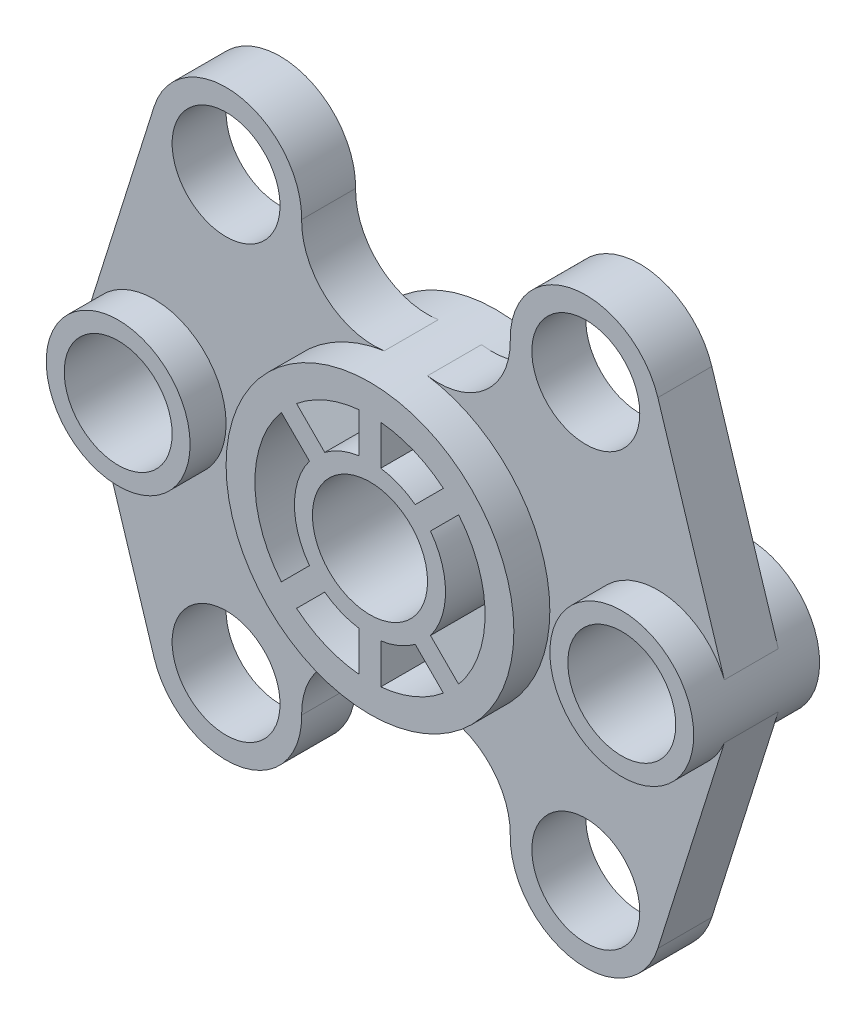
from build123d import *

# Parameters (mm, degrees)
SKETCH1_R           = 20
SKETCH1_R_2         = 15
SKETCH1_R_3         = 40
SKETCH1_R_4         = 32
SKETCH1_R_5         = 21
SKETCH1_R_6         = 16
BOSS_EXTRUDE1_DEPTH = 17.5
BOSS_EXTRUDE2_START = -7.5
SKETCH1_5_R         = 15
BOSS_EXTRUDE2_DEPTH = 15


with BuildPart() as part:
    # Sketch1 → Boss-Extrude1 (new, symmetric)
    # profile 1 of 10: a face of its own
    with BuildSketch(Plane.XY):
        with Locations((-70, 0)):
            Circle(SKETCH1_R)
        with Locations((-70, 0)):
            Circle(SKETCH1_R_2, mode=Mode.SUBTRACT)
    # profile 2 of 10: a face of its own
    with BuildSketch(Plane.XY):
        with Locations((70, 0)):
            Circle(SKETCH1_R)
        with Locations((70, 0)):
            Circle(SKETCH1_R_2, mode=Mode.SUBTRACT)
    # profile 3 of 10: a face of its own
    with BuildSketch(Plane.XY):
        Circle(SKETCH1_R_3)
        Circle(SKETCH1_R_4, mode=Mode.SUBTRACT)
    # profile 4 of 10: a face of its own
    with BuildSketch(Plane.XY):
        Circle(SKETCH1_R_5)
        Circle(SKETCH1_R_6, mode=Mode.SUBTRACT)
    # profile 5 of 10: a face of its own
    with BuildSketch(Plane.XY):
        with BuildLine():
            ThreePointArc((20.406440309, -24.649080996), (22.627416998, -22.627416998), (24.649080996, -20.406440309))
            Line((24.649080996, -20.406440309), (16.8182588, -12.575618113))
            ThreePointArc((16.8182588, -12.575618113), (14.849242405, -14.849242405), (12.575618113, -16.8182588))
            Line((12.575618113, -16.8182588), (20.406440309, -24.649080996))
        make_face()
    # profile 6 of 10: a face of its own
    with BuildSketch(Plane.XY):
        with BuildLine():
            ThreePointArc((-3, -31.859064644), (0, -32), (3, -31.859064644))
            Line((3, -31.859064644), (3, -20.784609691))
            ThreePointArc((3, -20.784609691), (0, -21), (-3, -20.784609691))
            Line((-3, -20.784609691), (-3, -31.859064644))
        make_face()
    # profile 7 of 10: a face of its own
    with BuildSketch(Plane.XY):
        with BuildLine():
            Line((-16.8182588, -12.575618113), (-24.649080996, -20.406440309))
            ThreePointArc((-24.649080996, -20.406440309), (-22.627416998, -22.627416998), (-20.406440309, -24.649080996))
            Line((-20.406440309, -24.649080996), (-12.575618113, -16.8182588))
            ThreePointArc((-12.575618113, -16.8182588), (-14.849242405, -14.849242405), (-16.8182588, -12.575618113))
        make_face()
    # profile 8 of 10: a face of its own
    with BuildSketch(Plane.XY):
        with BuildLine():
            Line((-12.575618113, 16.8182588), (-20.406440309, 24.649080996))
            ThreePointArc((-20.406440309, 24.649080996), (-22.627416998, 22.627416998), (-24.649080996, 20.406440309))
            Line((-24.649080996, 20.406440309), (-16.8182588, 12.575618113))
            ThreePointArc((-16.8182588, 12.575618113), (-14.849242405, 14.849242405), (-12.575618113, 16.8182588))
        make_face()
    # profile 9 of 10: a face of its own
    with BuildSketch(Plane.XY):
        with BuildLine():
            Line((3, 20.784609691), (3, 31.859064644))
            ThreePointArc((3, 31.859064644), (0, 32), (-3, 31.859064644))
            Line((-3, 31.859064644), (-3, 20.784609691))
            ThreePointArc((-3, 20.784609691), (0, 21), (3, 20.784609691))
        make_face()
    # profile 10 of 10: a face of its own
    with BuildSketch(Plane.XY):
        with BuildLine():
            ThreePointArc((24.649080996, 20.406440309), (22.627416998, 22.627416998), (20.406440309, 24.649080996))
            Line((20.406440309, 24.649080996), (12.575618113, 16.8182588))
            ThreePointArc((12.575618113, 16.8182588), (14.849242405, 14.849242405), (16.8182588, 12.575618113))
            Line((16.8182588, 12.575618113), (24.649080996, 20.406440309))
        make_face()
    extrude(amount=BOSS_EXTRUDE1_DEPTH, both=True)

    # Sketch1<5> → Boss-Extrude2 (add)
    # profile 1 of 2: a face of its own
    with BuildSketch(Plane.XY.offset(BOSS_EXTRUDE2_START)):
        with BuildLine():
            ThreePointArc((-29.002885891, -59.651863383), (-22.168588856, -44.262528341), (-6.003756239, -39.546869801))
            ThreePointArc((-6.003756239, -39.546869801), (-40, 0), (-6.003756239, 39.546869801))
            ThreePointArc((-6.003756239, 39.546869801), (-22.168588856, 44.262528341), (-29.002885891, 59.651863383))
            ThreePointArc((-29.002885891, 59.651863383), (-46.639863286, 80.729435141), (-70.031947242, 66.302466954))
            Line((-70.031947242, 66.302466954), (-88.505015581, 7.587120556))
            ThreePointArc((-88.505015581, 7.587120556), (-66.133497163, 19.622694917), (-50, 0))
            ThreePointArc((-50, 0), (-66.133497163, -19.622694917), (-88.505015581, -7.587120556))
            Line((-88.505015581, -7.587120556), (-70.031947242, -66.302466954))
            ThreePointArc((-70.031947242, -66.302466954), (-46.639863286, -80.729435141), (-29.002885891, -59.651863383))
        make_face()
        with Locations((-50, -60)):
            Circle(SKETCH1_5_R, mode=Mode.SUBTRACT)
        with Locations((-50, 60)):
            Circle(SKETCH1_5_R, mode=Mode.SUBTRACT)
    # profile 2 of 2: a face of its own
    with BuildSketch(Plane.XY.offset(BOSS_EXTRUDE2_START)):
        with BuildLine():
            ThreePointArc((29.002885891, -59.651863383), (46.639863286, -80.729435141), (70.031947242, -66.302466954))
            Line((70.031947242, -66.302466954), (88.505015581, -7.587120556))
            ThreePointArc((88.505015581, -7.587120556), (50, 0), (88.505015581, 7.587120556))
            Line((88.505015581, 7.587120556), (70.031947242, 66.302466954))
            ThreePointArc((70.031947242, 66.302466954), (46.639863286, 80.729435141), (29.002885891, 59.651863383))
            ThreePointArc((29.002885891, 59.651863383), (22.168588856, 44.262528341), (6.003756239, 39.546869801))
            ThreePointArc((6.003756239, 39.546869801), (30.332740146, 26.075369129), (40, 0))
            ThreePointArc((40, 0), (30.332740146, -26.075369129), (6.003756239, -39.546869801))
            ThreePointArc((6.003756239, -39.546869801), (22.168588856, -44.262528341), (29.002885891, -59.651863383))
        make_face()
        with Locations((50, -60)):
            Circle(SKETCH1_5_R, mode=Mode.SUBTRACT)
        with Locations((50, 60)):
            Circle(SKETCH1_5_R, mode=Mode.SUBTRACT)
    extrude(amount=BOSS_EXTRUDE2_DEPTH)


solid = part.part
